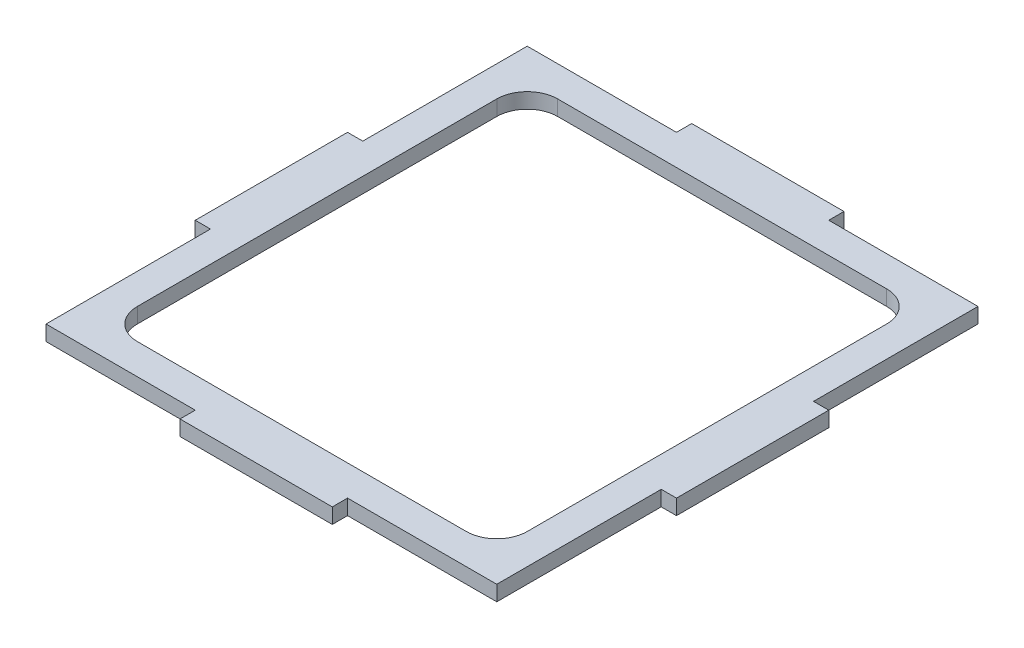
from build123d import *

# Parameters (mm, degrees)
SKIZZE1_W                       = 148
SKIZZE1_H                       = 158
AUFSATZ_LINEAR_AUSTRAGEN1_DEPTH = 5
SKIZZE2_W                       = 158
SKIZZE2_H                       = 50
AUFSATZ_LINEAR_AUSTRAGEN2_DEPTH = 5
SKIZZE3_W                       = 50
SKIZZE3_H                       = 168
AUFSATZ_LINEAR_AUSTRAGEN3_DEPTH = 5
SKIZZE4_R                       = 50
SCHNITT_LINEAR_AUSTRAGEN1_DEPTH = 5
SKIZZE5_W                       = 128
SKIZZE5_H                       = 138
SCHNITT_LINEAR_AUSTRAGEN2_DEPTH = 116.420968632
VERRUNDUNG1_R                   = 10


with BuildPart() as part:
    # Skizze1 → Aufsatz-Linear austragen1 (new body)
    with BuildSketch(Plane(origin=(0, 0, 0), x_dir=(1, 0, 0), z_dir=(0, 1, 0))):
        Rectangle(SKIZZE1_W, SKIZZE1_H)
    extrude(amount=AUFSATZ_LINEAR_AUSTRAGEN1_DEPTH)

    # Skizze2 → Aufsatz-Linear austragen2 (add)
    with BuildSketch(Plane(origin=(0, 5, 0), x_dir=(1, 0, 0), z_dir=(0, 1, 0))):
        Rectangle(SKIZZE2_W, SKIZZE2_H)
    extrude(amount=-AUFSATZ_LINEAR_AUSTRAGEN2_DEPTH)

    # Skizze3 → Aufsatz-Linear austragen3 (add)
    with BuildSketch(Plane(origin=(0, 5, 0), x_dir=(1, 0, 0), z_dir=(0, 1, 0))):
        Rectangle(SKIZZE3_W, SKIZZE3_H)
    extrude(amount=-AUFSATZ_LINEAR_AUSTRAGEN3_DEPTH)

    # Skizze4 → Schnitt-Linear austragen1 (cut)
    with BuildSketch(Plane(origin=(0, 5, 0), x_dir=(1, 0, 0), z_dir=(0, 1, 0))):
        Circle(SKIZZE4_R)
    extrude(amount=-SCHNITT_LINEAR_AUSTRAGEN1_DEPTH, mode=Mode.SUBTRACT)

    # Skizze5 → Schnitt-Linear austragen2 (cut, through all)
    with BuildSketch(Plane(origin=(0, 5, 0), x_dir=(1, 0, 0), z_dir=(0, 1, 0))):
        Rectangle(SKIZZE5_W, SKIZZE5_H)
    extrude(amount=-SCHNITT_LINEAR_AUSTRAGEN2_DEPTH, mode=Mode.SUBTRACT)

    # Verrundung1
    verrundung1_edges = [part.edges().sort_by_distance(p)[0] for p in [
        (-64, 2.5, 69),
        (64, 2.5, 69),
        (64, 2.5, -69),
        (-64, 2.5, -69),
    ]]
    fillet(verrundung1_edges, radius=VERRUNDUNG1_R)


solid = part.part
